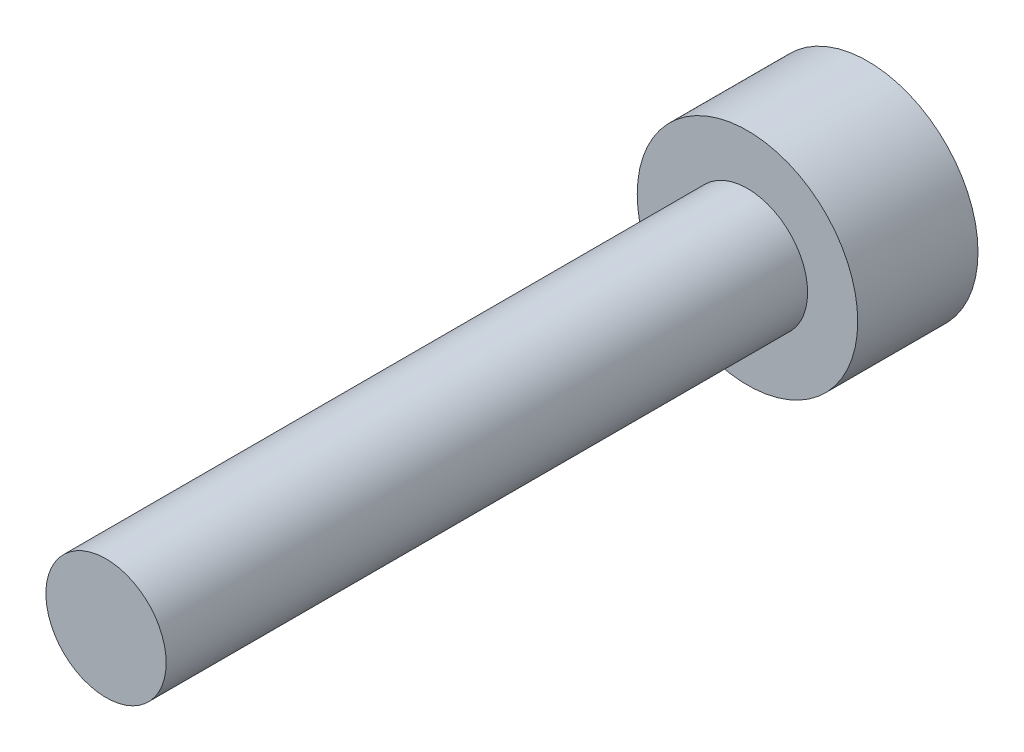
from build123d import *

# Parameters (mm, degrees)
SKETCH_1_R        = 1.5
EXTRUDE_246_DEPTH = 16
EXTRUDE_START     = -3
SKETCH_2_R        = 2.75
EXTRUDE_315_DEPTH = 3


with BuildPart() as part:
    # 草图1 → Extrude 246 (new body)
    with BuildSketch(Plane.XY):
        Circle(SKETCH_1_R)
    extrude(amount=EXTRUDE_246_DEPTH)

    # 草图2 → Extrude 315 (add)
    with BuildSketch(Plane.XY.offset(EXTRUDE_START)):
        Circle(SKETCH_2_R)
    extrude(amount=EXTRUDE_315_DEPTH)


solid = part.part
